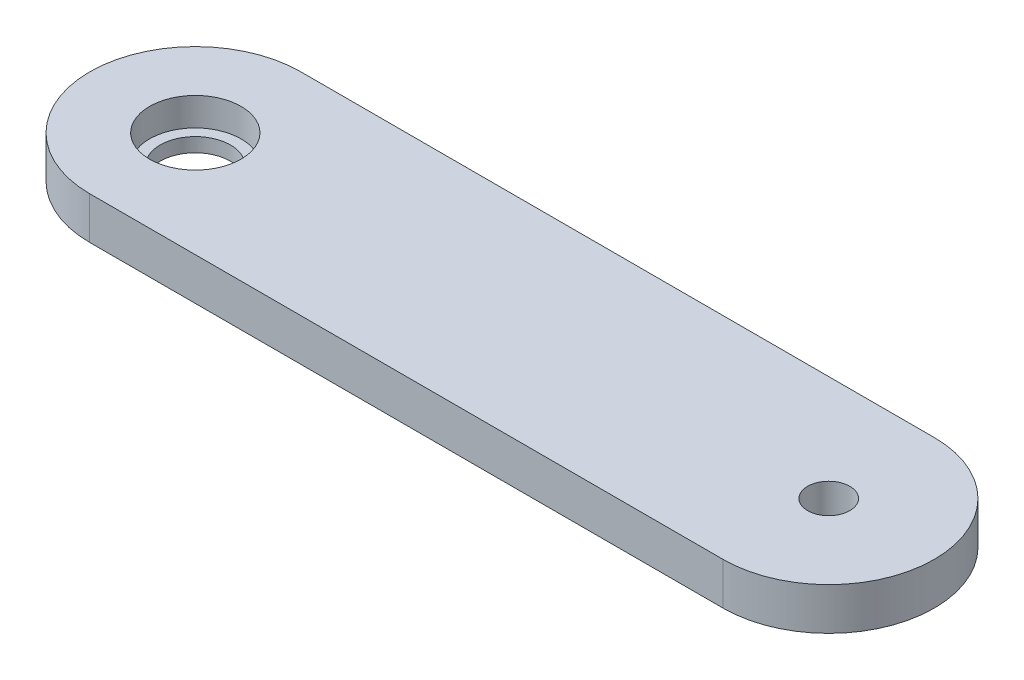
from build123d import *

# Parameters (mm, degrees)
SKETCH2_R           = 5
SKETCH2_R_2         = 3
BOSS_EXTRUDE1_DEPTH = 6
SKETCH3_R           = 6.5
CUT_EXTRUDE1_DEPTH  = 4


with BuildPart() as part:
    # Sketch2 → Boss-Extrude1 (new body)
    with BuildSketch(Plane(origin=(0, 0, 0), x_dir=(1, 0, 0), z_dir=(0, 1, 0))):
        with BuildLine():
            Line((-45, 15), (45, 15))
            ThreePointArc((45, 15), (60, 0), (45, -15))
            Line((45, -15), (-45, -15))
            ThreePointArc((-45, -15), (-60, 0), (-45, 15))
        make_face()
        with Locations(Location((-45, 0, 0), (0, 0, 270))):
            Circle(SKETCH2_R, mode=Mode.SUBTRACT)
        with Locations(Location((45, 0, 0), (0, 0, 270))):
            Circle(SKETCH2_R_2, mode=Mode.SUBTRACT)
    extrude(amount=BOSS_EXTRUDE1_DEPTH)

    # Sketch3 → Cut-Extrude1 (cut)
    with BuildSketch(Plane(origin=(0, 6, 0), x_dir=(1, 0, 0), z_dir=(0, 1, 0))):
        with Locations(Location((-45, 0, 0), (0, 0, 270))):
            Circle(SKETCH3_R)
    extrude(amount=-CUT_EXTRUDE1_DEPTH, mode=Mode.SUBTRACT)


solid = part.part
